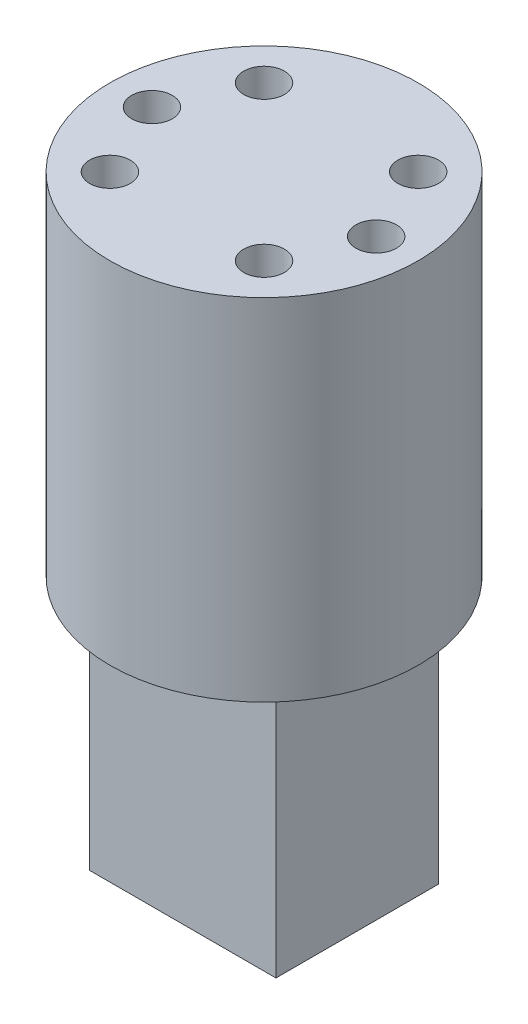
from build123d import *

# Parameters (mm, degrees)
SKETCH2_R                  = 11
BOSS_EXTRUDE1_DEPTH        = 25
SKETCH3_W                  = 13.3
SKETCH3_H                  = 11.6
BOSS_EXTRUDE2_DEPTH        = 18.6
M2_5_CLEARANCE_HOLE1_D     = 2.9
M2_5_CLEARANCE_HOLE1_DEPTH = 5
M2_5_CLEARANCE_HOLE1_TIP   = 0.871247898


with BuildPart() as part:
    # Sketch2 → Boss-Extrude1 (new body)
    with BuildSketch(Plane(origin=(0, 0, 0), x_dir=(1, 0, 0), z_dir=(0, 1, 0))):
        with Locations(Location((0, 0, 0), (0, 0, 270))):
            Circle(SKETCH2_R)
    extrude(amount=-BOSS_EXTRUDE1_DEPTH)

    # Sketch3 → Boss-Extrude2 (add)
    with BuildSketch(Plane.XZ.offset(25)):
        Rectangle(SKETCH3_W, SKETCH3_H)
    extrude(amount=BOSS_EXTRUDE2_DEPTH)

    # Sketch4 → Revolve1 (revolve)
    with BuildSketch(Plane.XY):
        Polygon((-2.5, -43.6), (0, -45.6), (0, -43.6), align=None)
    revolve(axis=Axis((0, -45.6, 0), (0, 1, 0)))

    # M2.5 Clearance Hole1
    with Locations(Plane(origin=(0, 0, 0), x_dir=(1, 0, 0), z_dir=(0, 1, 0))):
        with Locations((-5.5, 5.5), (5.5, -5.5), (-5.5, -5.5), (5.5, 5.5), (8, 0), (-8, 0)):
            Hole(M2_5_CLEARANCE_HOLE1_D / 2, depth=M2_5_CLEARANCE_HOLE1_DEPTH)
            with Locations((0, 0, -(M2_5_CLEARANCE_HOLE1_DEPTH + M2_5_CLEARANCE_HOLE1_TIP / 2))):  # 118° drill point
                Cone(0, M2_5_CLEARANCE_HOLE1_D / 2, M2_5_CLEARANCE_HOLE1_TIP, mode=Mode.SUBTRACT)


solid = part.part
